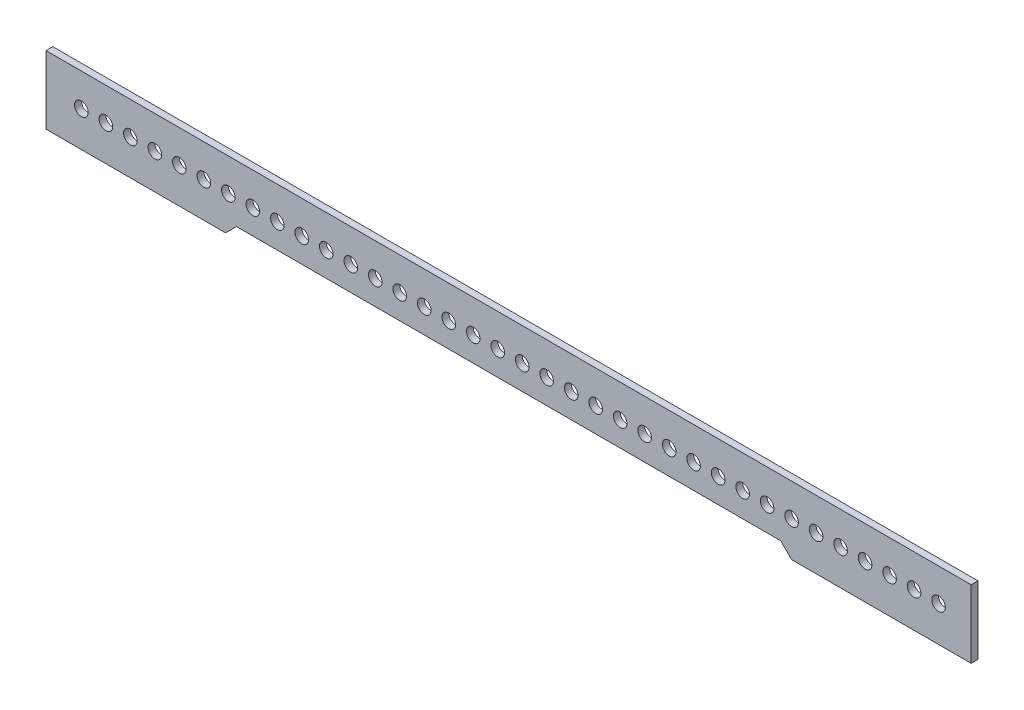
from build123d import *

# Parameters (mm, degrees)
BOSS_EXTRUDE1_DEPTH = 3.175
SKETCH3_R           = 3.175
CUT_EXTRUDE2_DEPTH  = 219.245167472


with BuildPart() as part:
    # Sketch1 → Boss-Extrude1 (new body)
    with BuildSketch(Plane.XY):
        Polygon((-215.9, 0), (215.9, 0), (215.9, -31.75), (132.08, -31.75), (127, -26.67), (-127, -26.67), (-132.08, -31.75), (-215.9, -31.75), align=None)
    extrude(amount=BOSS_EXTRUDE1_DEPTH)

    # Sketch3 → Cut-Extrude2 (cut, through all)
    with BuildSketch(Plane.XY.offset(3.175)):
        with Locations((-199.39, -15.24)):
            Circle(SKETCH3_R)
        with Locations((-187.96, -15.24)):
            Circle(SKETCH3_R)
        with Locations((-176.53, -15.24)):
            Circle(SKETCH3_R)
        with Locations((-165.1, -15.24)):
            Circle(SKETCH3_R)
        with Locations((-153.67, -15.24)):
            Circle(SKETCH3_R)
        with Locations((-142.24, -15.24)):
            Circle(SKETCH3_R)
        with Locations((-130.81, -15.24)):
            Circle(SKETCH3_R)
        with Locations((-119.38, -15.24)):
            Circle(SKETCH3_R)
        with Locations((-107.95, -15.24)):
            Circle(SKETCH3_R)
        with Locations((-96.52, -15.24)):
            Circle(SKETCH3_R)
        with Locations((-85.09, -15.24)):
            Circle(SKETCH3_R)
        with Locations((-73.66, -15.24)):
            Circle(SKETCH3_R)
        with Locations((-62.23, -15.24)):
            Circle(SKETCH3_R)
        with Locations((-50.8, -15.24)):
            Circle(SKETCH3_R)
        with Locations((-39.37, -15.24)):
            Circle(SKETCH3_R)
        with Locations((-27.94, -15.24)):
            Circle(SKETCH3_R)
        with Locations((-16.51, -15.24)):
            Circle(SKETCH3_R)
        with Locations((-5.08, -15.24)):
            Circle(SKETCH3_R)
        with Locations((6.35, -15.24)):
            Circle(SKETCH3_R)
        with Locations((17.78, -15.24)):
            Circle(SKETCH3_R)
        with Locations((29.21, -15.24)):
            Circle(SKETCH3_R)
        with Locations((40.64, -15.24)):
            Circle(SKETCH3_R)
        with Locations((52.07, -15.24)):
            Circle(SKETCH3_R)
        with Locations((63.5, -15.24)):
            Circle(SKETCH3_R)
        with Locations((74.93, -15.24)):
            Circle(SKETCH3_R)
        with Locations((86.36, -15.24)):
            Circle(SKETCH3_R)
        with Locations((97.79, -15.24)):
            Circle(SKETCH3_R)
        with Locations((109.22, -15.24)):
            Circle(SKETCH3_R)
        with Locations((120.65, -15.24)):
            Circle(SKETCH3_R)
        with Locations((132.08, -15.24)):
            Circle(SKETCH3_R)
        with Locations((143.51, -15.24)):
            Circle(SKETCH3_R)
        with Locations((154.94, -15.24)):
            Circle(SKETCH3_R)
        with Locations((166.37, -15.24)):
            Circle(SKETCH3_R)
        with Locations((177.8, -15.24)):
            Circle(SKETCH3_R)
        with Locations((189.23, -15.24)):
            Circle(SKETCH3_R)
        with Locations((200.66, -15.24)):
            Circle(SKETCH3_R)
    extrude(amount=-CUT_EXTRUDE2_DEPTH, mode=Mode.SUBTRACT)


solid = part.part
